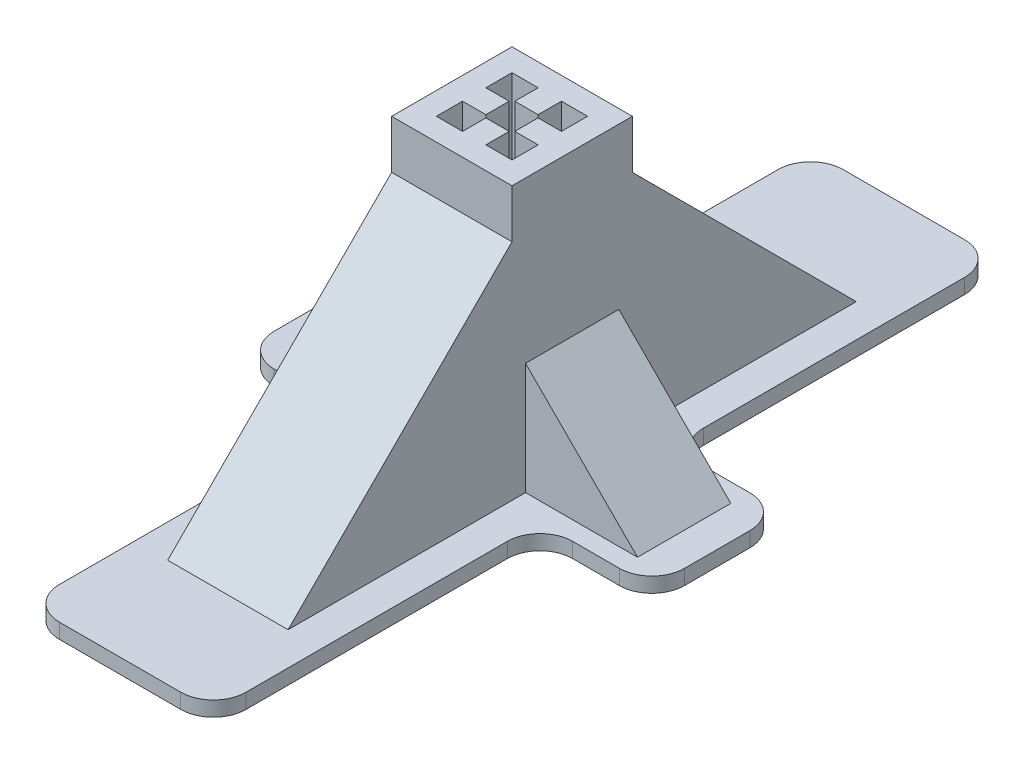
from build123d import *

# Parameters (mm, degrees)
SKETCH2_W            = 32.25
SKETCH2_H            = 32.25
BOSS_EXTRUDE1_DEPTH  = 75
SKETCH3_W            = 32.25
SKETCH3_H            = 32.25
BOSS_EXTRUDE2_DEPTH  = 2
SKETCH4_W            = 32.25
SKETCH4_H            = 32.25
BOSS_EXTRUDE3_DEPTH  = 4
FILLET1_R            = 8.75
BOSS_EXTRUDE4_DEPTH  = 32.25
BOSS_EXTRUDE12_DEPTH = 12.5


with BuildPart() as part:
    # Sketch2 → Boss-Extrude1 (new body)
    with BuildSketch(Plane(origin=(0, 0, 0), x_dir=(1, 0, 0), z_dir=(0, 1, 0))):
        Rectangle(SKETCH2_W, SKETCH2_H)
        Polygon((-3.125, 10.125), (-3.125, 3.875), (3.125, 3.875), (3.125, 10.125), (10.125, 10.125), (10.125, 3.125), (3.875, 3.125), (3.875, -3.125), (10.125, -3.125), (10.125, -10.125), (3.125, -10.125), (3.125, -3.875), (-3.125, -3.875), (-3.125, -10.125), (-10.125, -10.125), (-10.125, -3.125), (-3.875, -3.125), (-3.875, 3.125), (-10.125, 3.125), (-10.125, 10.125), align=None, mode=Mode.SUBTRACT)
    extrude(amount=BOSS_EXTRUDE1_DEPTH)

    # Sketch3 → Boss-Extrude2 (add)
    with BuildSketch(Plane.XZ):
        Rectangle(SKETCH3_W, SKETCH3_H)
    extrude(amount=BOSS_EXTRUDE2_DEPTH)

    # Sketch4 → Boss-Extrude3 (add)
    with BuildSketch(Plane.XZ.offset(2)):
        Polygon((-25, 17.5), (-25, 105), (25, 105), (25, 17.5), (55, 17.5), (55, -17.5), (25, -17.5), (25, -105), (-25, -105), (-25, -17.5), (-55, -17.5), (-55, 17.5), align=None)
        Rectangle(SKETCH4_W, SKETCH4_H, mode=Mode.SUBTRACT)
    extrude(amount=-BOSS_EXTRUDE3_DEPTH)

    # Fillet1
    fillet1_edges = [part.edges().sort_by_distance(p)[0] for p in [
        (-25, 0, -105),
        (-25, 0, -17.5),
        (-55, 0, -17.5),
        (-55, 0, 17.5),
        (-25, 0, 17.5),
        (-25, 0, 105),
        (25, 0, 105),
        (25, 0, 17.5),
        (55, 0, 17.5),
        (55, 0, -17.5),
        (25, 0, -17.5),
        (25, 0, -105),
    ]]
    fillet(fillet1_edges, radius=FILLET1_R)

    # Sketch5 → Boss-Extrude4 (add)
    with BuildSketch(Plane(origin=(16.125, 0, 0), x_dir=(0, 0, -1), z_dir=(1, 0, 0))):
        Polygon((16.125, 62), (76.125, 2), (16.125, 2), align=None)
        Polygon((-16.125, 62), (-76.125, 2), (-16.125, 2), align=None)
    extrude(amount=-BOSS_EXTRUDE4_DEPTH)

    # Sketch7 → Boss-Extrude12 (add, symmetric)
    with BuildSketch(Plane.XY):
        Polygon((-16.125, 2), (-46.125, 2), (-16.125, 32), align=None)
        Polygon((46.125, 2), (16.125, 32), (16.125, 2), align=None)
    extrude(amount=BOSS_EXTRUDE12_DEPTH, both=True)


solid = part.part
